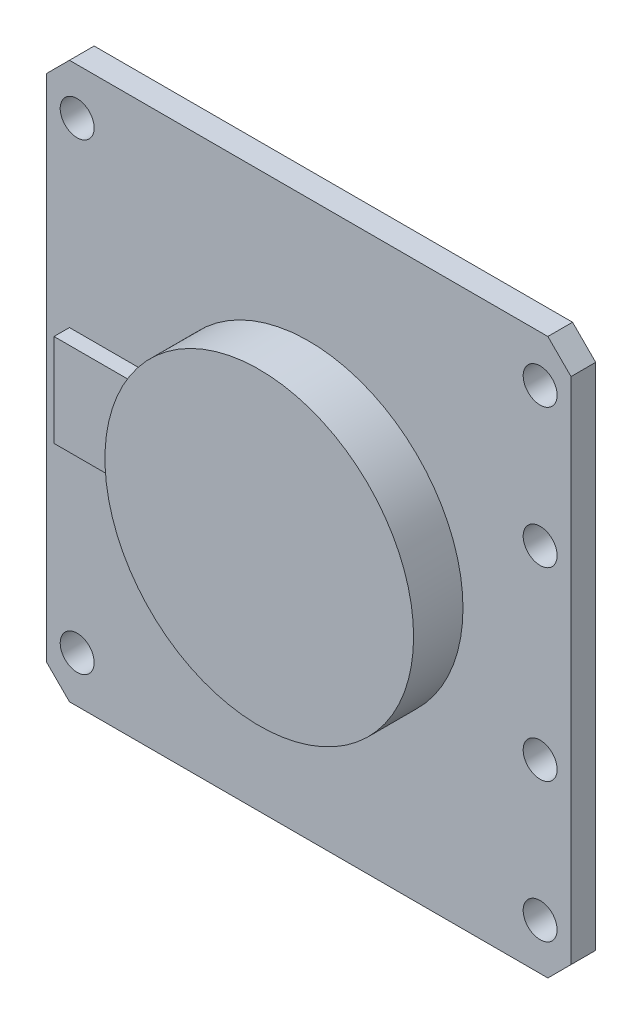
from build123d import *

# Parameters (mm, degrees)
SKETCH1_W           = 34
SKETCH1_H           = 36
BOSS_EXTRUDE1_DEPTH = 1.6
CHAMFER1_SIZE       = 1.5
SKETCH2_R           = 1.1
CUT_EXTRUDE1_DEPTH  = 25.810481656
SKETCH3_R           = 10
BOSS_EXTRUDE2_DEPTH = 3.2
SKETCH4_W           = 5
SKETCH4_H           = 6
BOSS_EXTRUDE3_DEPTH = 1


with BuildPart() as part:
    # Sketch1 → Boss-Extrude1 (new body)
    with BuildSketch(Plane.XY):
        Rectangle(SKETCH1_W, SKETCH1_H)
    extrude(amount=BOSS_EXTRUDE1_DEPTH)

    # Chamfer1
    chamfer1_edges = [part.edges().sort_by_distance(p)[0] for p in [
        (-17, 18, 0.8),
        (17, 18, 0.8),
        (17, -18, 0.8),
        (-17, -18, 0.8),
    ]]
    chamfer(chamfer1_edges, length=CHAMFER1_SIZE)

    # Sketch2 → Cut-Extrude1 (cut, through all)
    with BuildSketch(Plane.XY.offset(1.6)):
        with Locations((-15, 15)):
            Circle(SKETCH2_R)
        with Locations((15, 6)):
            Circle(SKETCH2_R)
        with Locations(Location((-15, -15, 0), (0, 0, 180))):
            Circle(SKETCH2_R)
        with Locations((15, -15)):
            Circle(SKETCH2_R)
        with Locations(Location((15, 15, 0), (0, 0, 180))):
            Circle(SKETCH2_R)
        with Locations(Location((15, -6, 0), (0, 0, 180))):
            Circle(SKETCH2_R)
    extrude(amount=-CUT_EXTRUDE1_DEPTH, mode=Mode.SUBTRACT)

    # Sketch3 → Boss-Extrude2 (add)
    with BuildSketch(Plane.XY.offset(1.6)):
        Circle(SKETCH3_R)
    extrude(amount=BOSS_EXTRUDE2_DEPTH)

    # Sketch4 → Boss-Extrude3 (add)
    with BuildSketch(Plane.XY.offset(1.6)):
        with Locations((-13, 0)):
            Rectangle(SKETCH4_W, SKETCH4_H)
    extrude(amount=BOSS_EXTRUDE3_DEPTH)


solid = part.part
